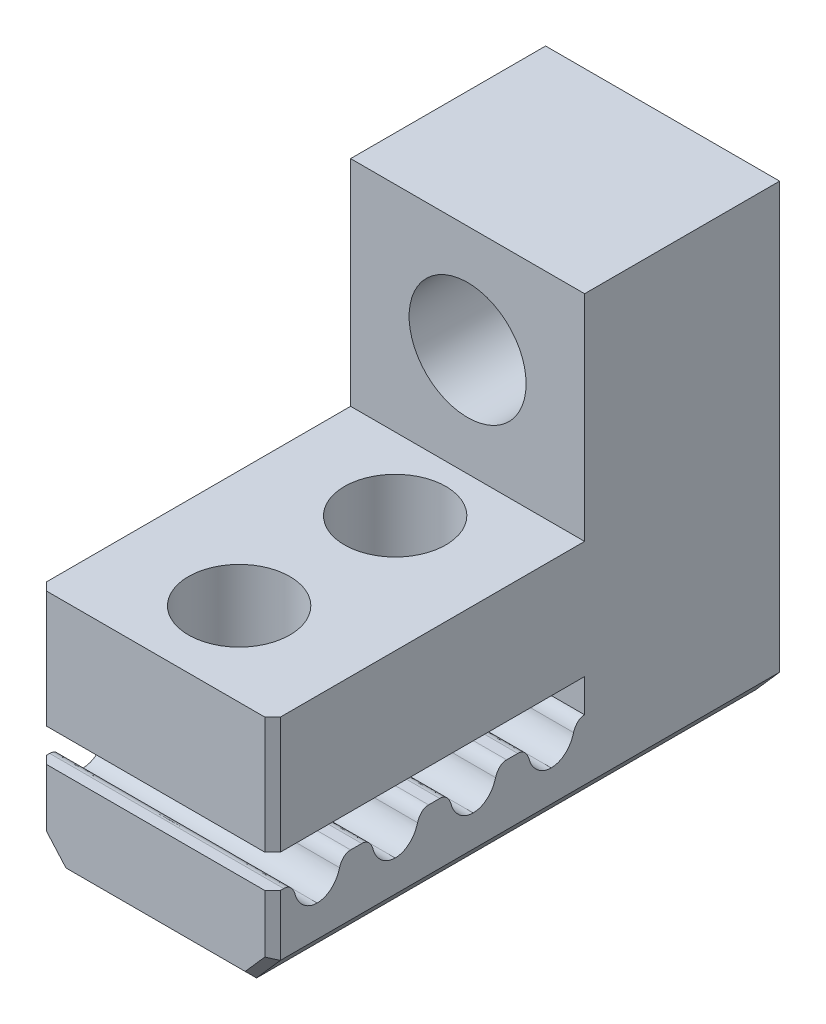
from build123d import *

# Parameters (mm, degrees)
BOSS_EXTRUDE1_DEPTH     = 13
SKETCH6_W               = 6
SKETCH6_H               = 5
BOSS_EXTRUDE4_DEPTH     = 5.6
SKETCH16_W              = 6
SKETCH16_H              = 8
BOSS_EXTRUDE5_DEPTH     = 0.1
CUT_EXTRUDE6_DEPTH      = 4
CUT_EXTRUDE6_DEPTH_BACK = 3.6
SKETCH15_R              = 1.3
CUT_EXTRUDE7_DEPTH      = 8.7202
CUT_EXTRUDE8_START      = -0.2202
SKETCH19_W              = 6
SKETCH19_H              = 8
SKETCH19_R              = 1.3
CUT_EXTRUDE8_DEPTH      = 0.2202
SKETCH12_R              = 1.5
CUT_EXTRUDE5_DEPTH      = 6
CHAMFER1_SIZE           = 0.2
SKETCH20_W              = 5
SKETCH20_H              = 5.5
BOSS_EXTRUDE6_DEPTH     = 0.5
SKETCH21_W              = 5
SKETCH21_H              = 5.5
BOSS_EXTRUDE7_DEPTH     = 0.5
CHAMFER2_SIZE           = 0.2
CROQUIS1_W              = 5
CROQUIS1_H              = 5.5
CORTAR_EXTRUIR1_DEPTH   = 0.5
CROQUIS2_W              = 5
CROQUIS2_H              = 5.5
CORTAR_EXTRUIR2_DEPTH   = 1


with BuildPart() as part:
    # Sketch1 → Boss-Extrude1 (new body)
    with BuildSketch(Plane.XY):
        Polygon((3, 3.05), (3, -2.253801214), (2.388188946, -2.95), (-2.388188946, -2.95), (-3, -2.253801214), (-3, 3.05), align=None)
    extrude(amount=BOSS_EXTRUDE1_DEPTH)

    # Sketch6 → Boss-Extrude4 (add)
    with BuildSketch(Plane(origin=(0, 3.05, 0), x_dir=(1, 0, 0), z_dir=(0, 1, 0))):
        with Locations((0, -2.5)):
            Rectangle(SKETCH6_W, SKETCH6_H)
    extrude(amount=BOSS_EXTRUDE4_DEPTH)

    # Sketch16 → Boss-Extrude5 (add)
    with BuildSketch(Plane(origin=(0, 3.05, 0), x_dir=(1, 0, 0), z_dir=(0, 1, 0))):
        with Locations((0, -9)):
            Rectangle(SKETCH16_W, SKETCH16_H)
    extrude(amount=BOSS_EXTRUDE5_DEPTH)

    # Sketch18 → Cut-Extrude6 (cut, two sides: drawn at the far end of the back side and taken through both)
    with BuildSketch(Plane(origin=(0, 0, 0), x_dir=(0, 0, -1), z_dir=(1, 0, 0)).offset(-CUT_EXTRUDE6_DEPTH_BACK)):
        with BuildLine():
            Line((-8.8572, -0.0702), (-12.8572, -0.0702))
            Line((-12.8572, -0.0702), (-13, -0.0702))
            Line((-13, -0.0702), (-13, -0.7))
            Line((-13, -0.7), (-12.8572, -0.7))
            Line((-12.8572, -0.7), (-12.7144, -0.7))
            add(Edge.make_bspline(
                [(-12.7144, -0.7), (-12.5198, -0.7), (-12.43, -0.9509)],
                knots=[0.103448276, 0.103448276, 0.103448276, 0.137931034, 0.137931034, 0.137931034], degree=2))
            add(Edge.make_bspline(
                [(-12.43, -0.9509), (-12.3594, -1.2388), (-12.13, -1.45), (-11.8572, -1.45)],
                knots=[0.137931034, 0.137931034, 0.137931034, 0.137931034, 0.172413793, 0.172413793, 0.172413793, 0.172413793], degree=3))
            add(Edge.make_bspline(
                [(-11.8572, -1.45), (-11.5844, -1.45), (-11.355, -1.2388), (-11.2844, -0.9509)],
                knots=[0.172413793, 0.172413793, 0.172413793, 0.172413793, 0.206896552, 0.206896552, 0.206896552, 0.206896552], degree=3))
            add(Edge.make_bspline(
                [(-11.2844, -0.9509), (-11.1946, -0.7), (-11, -0.7)],
                knots=[0.206896552, 0.206896552, 0.206896552, 0.24137931, 0.24137931, 0.24137931], degree=2))
            Line((-11, -0.7), (-10.8572, -0.7))
            Line((-10.8572, -0.7), (-10.7144, -0.7))
            add(Edge.make_bspline(
                [(-10.7144, -0.7), (-10.5198, -0.7), (-10.43, -0.9509)],
                knots=[0.310344828, 0.310344828, 0.310344828, 0.344827586, 0.344827586, 0.344827586], degree=2))
            add(Edge.make_bspline(
                [(-10.43, -0.9509), (-10.3594, -1.2388), (-10.13, -1.45), (-9.8572, -1.45)],
                knots=[0.344827586, 0.344827586, 0.344827586, 0.344827586, 0.379310345, 0.379310345, 0.379310345, 0.379310345], degree=3))
            add(Edge.make_bspline(
                [(-9.8572, -1.45), (-9.5844, -1.45), (-9.355, -1.2388), (-9.2844, -0.9509)],
                knots=[0.379310345, 0.379310345, 0.379310345, 0.379310345, 0.413793103, 0.413793103, 0.413793103, 0.413793103], degree=3))
            add(Edge.make_bspline(
                [(-9.2844, -0.9509), (-9.1946, -0.7), (-9, -0.7)],
                knots=[0.413793103, 0.413793103, 0.413793103, 0.448275862, 0.448275862, 0.448275862], degree=2))
            Line((-9, -0.7), (-8.8572, -0.7))
            Line((-8.8572, -0.7), (-8.7144, -0.7))
            add(Edge.make_bspline(
                [(-8.7144, -0.7), (-8.5198, -0.7), (-8.43, -0.9509)],
                knots=[0.517241379, 0.517241379, 0.517241379, 0.551724138, 0.551724138, 0.551724138], degree=2))
            add(Edge.make_bspline(
                [(-8.43, -0.9509), (-8.3594, -1.2388), (-8.13, -1.45), (-7.8572, -1.45)],
                knots=[0.551724138, 0.551724138, 0.551724138, 0.551724138, 0.586206897, 0.586206897, 0.586206897, 0.586206897], degree=3))
            add(Edge.make_bspline(
                [(-7.8572, -1.45), (-7.5844, -1.45), (-7.355, -1.2388), (-7.2844, -0.9509)],
                knots=[0.586206897, 0.586206897, 0.586206897, 0.586206897, 0.620689655, 0.620689655, 0.620689655, 0.620689655], degree=3))
            add(Edge.make_bspline(
                [(-7.2844, -0.9509), (-7.1946, -0.7), (-7, -0.7)],
                knots=[0.620689655, 0.620689655, 0.620689655, 0.655172414, 0.655172414, 0.655172414], degree=2))
            Line((-7, -0.7), (-6.8572, -0.7))
            Line((-6.8572, -0.7), (-6.7144, -0.7))
            add(Edge.make_bspline(
                [(-6.7144, -0.7), (-6.5198, -0.7), (-6.43, -0.9509)],
                knots=[0.724137931, 0.724137931, 0.724137931, 0.75862069, 0.75862069, 0.75862069], degree=2))
            add(Edge.make_bspline(
                [(-6.43, -0.9509), (-6.3594, -1.2388), (-6.13, -1.45), (-5.8572, -1.45)],
                knots=[0.75862069, 0.75862069, 0.75862069, 0.75862069, 0.793103448, 0.793103448, 0.793103448, 0.793103448], degree=3))
            add(Edge.make_bspline(
                [(-5.8572, -1.45), (-5.5844, -1.45), (-5.355, -1.2388), (-5.2844, -0.9509)],
                knots=[0.793103448, 0.793103448, 0.793103448, 0.793103448, 0.827586207, 0.827586207, 0.827586207, 0.827586207], degree=3))
            add(Edge.make_bspline(
                [(-5.2844, -0.9509), (-5.1946, -0.7), (-5, -0.7)],
                knots=[0.827586207, 0.827586207, 0.827586207, 0.862068966, 0.862068966, 0.862068966], degree=2))
            Line((-5, -0.7), (-5, -0.0702))
            Line((-5, -0.0702), (-8.8572, -0.0702))
        make_face()
    extrude(amount=CUT_EXTRUDE6_DEPTH + CUT_EXTRUDE6_DEPTH_BACK, mode=Mode.SUBTRACT)

    # Sketch15 → Cut-Extrude7 (cut)
    with BuildSketch(Plane(origin=(0, 8.65, 0), x_dir=(1, 0, 0), z_dir=(0, 1, 0))):
        with Locations(Location((0, -10.8572, 0), (0, 0, 180))):
            Circle(SKETCH15_R)
        with Locations(Location((0, -6.8572, 0), (0, 0, 180))):
            Circle(SKETCH15_R)
    extrude(amount=-CUT_EXTRUDE7_DEPTH, mode=Mode.SUBTRACT)

    # Sketch19 → Cut-Extrude8 (cut)
    with BuildSketch(Plane.XZ.offset(0.0702).offset(CUT_EXTRUDE8_START)):
        with Locations((0, 9)):
            Rectangle(SKETCH19_W, SKETCH19_H)
        with Locations(Location((0, 10.8572, 0), (0, 0, 180))):
            Circle(SKETCH19_R, mode=Mode.SUBTRACT)
        with Locations(Location((0, 6.8572, 0), (0, 0, 180))):
            Circle(SKETCH19_R, mode=Mode.SUBTRACT)
    extrude(amount=CUT_EXTRUDE8_DEPTH, mode=Mode.SUBTRACT)

    # Sketch12 → Cut-Extrude5 (cut)
    with BuildSketch(Plane.XY.offset(5)):
        with Locations((0, 5.9)):
            Circle(SKETCH12_R)
    extrude(amount=-CUT_EXTRUDE5_DEPTH, mode=Mode.SUBTRACT)

    # Chamfer1
    chamfer1_edges = [part.edges().sort_by_distance(p)[0] for p in [
        (-2.694094473, -2.601900607, 13),
        (0, -2.95, 13),
        (2.694094473, -2.601900607, 13),
        (3, 1.65, 13),
        (3, -1.476900607, 13),
        (-3, -1.476900607, 13),
        (-3, 1.65, 13),
    ]]
    chamfer(chamfer1_edges, length=CHAMFER1_SIZE)

    # Sketch20 → Boss-Extrude6 (add)
    with BuildSketch(Plane(origin=(3, 0, 0), x_dir=(0, 0, -1), z_dir=(1, 0, 0))):
        with Locations((-2.5, 5.9)):
            Rectangle(SKETCH20_W, SKETCH20_H)
    extrude(amount=BOSS_EXTRUDE6_DEPTH)

    # Sketch21 → Boss-Extrude7 (add)
    with BuildSketch(Plane.ZY.offset(3)):
        with Locations((2.5, 5.9)):
            Rectangle(SKETCH21_W, SKETCH21_H)
    extrude(amount=BOSS_EXTRUDE7_DEPTH)

    # Chamfer2
    chamfer2_edges = [part.edges().sort_by_distance(p)[0] for p in [
        (3.5, 5.9, 5),
        (-3.5, 5.9, 5),
    ]]
    chamfer(chamfer2_edges, length=CHAMFER2_SIZE)

    # Croquis1 → Cortar-Extruir1 (cut)
    with BuildSketch(Plane.ZY.offset(3.5)):
        with Locations((2.5, 5.9)):
            Rectangle(CROQUIS1_W, CROQUIS1_H)
    extrude(amount=-CORTAR_EXTRUIR1_DEPTH, mode=Mode.SUBTRACT)

    # Croquis2 → Cortar-Extruir2 (cut)
    with BuildSketch(Plane(origin=(3, 0, 0), x_dir=(0, 0, -1), z_dir=(1, 0, 0))):
        with Locations((-2.5, 5.9)):
            Rectangle(CROQUIS2_W, CROQUIS2_H)
    extrude(amount=CORTAR_EXTRUIR2_DEPTH, mode=Mode.SUBTRACT)


solid = part.part
